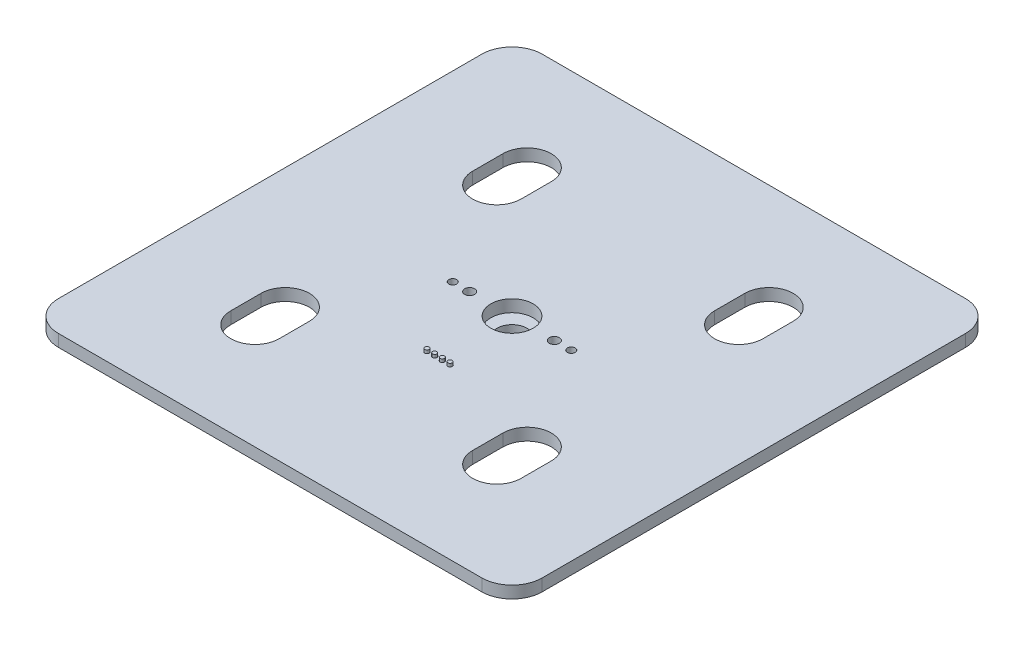
from build123d import *

# Parameters (mm, degrees)
SKETCH1_W                  = 80
SKETCH1_H                  = 80
BOSS_EXTRUDE1_DEPTH        = 1
FILLET1_R                  = 5
FILLET3_R                  = 5
FILLET4_R                  = 5
FILLET5_R                  = 5
CUT_EXTRUDE1_DEPTH         = 57.603886792
CUT_EXTRUDE1_DEPTH_BACK    = 57.603886792
CUT_EXTRUDE2_DEPTH         = 57.603886792
CUT_EXTRUDE2_DEPTH_BACK    = 57.603886792
SKETCH3_R                  = 3.5
CUT_EXTRUDE3_DEPTH         = 57.603886792
CUT_EXTRUDE3_DEPTH_BACK    = 57.603886792
SKETCH4_R                  = 0.38
SKETCH4_R_2                = 0.65
SKETCH4_R_3                = 0.825
BOSS_EXTRUDE2_START        = 1
BOSS_EXTRUDE2_DEPTH        = 4
BOSS_EXTRUDE3_DEPTH        = 0.5
BOSS_EXTRUDE3_DEPTH_BACK   = 5
SKETCH7_R                  = 0.35
BOSS_EXTRUDE3_2_DEPTH      = 0.5
BOSS_EXTRUDE3_2_DEPTH_BACK = 5
BOSS_EXTRUDE3_3_DEPTH      = 0.5
BOSS_EXTRUDE3_3_DEPTH_BACK = 5
BOSS_EXTRUDE3_4_DEPTH      = 0.5
BOSS_EXTRUDE3_4_DEPTH_BACK = 5
SKETCH8_W                  = 0.7
SKETCH8_H                  = 0.7
BOSS_EXTRUDE4_DEPTH        = 1.1
CUT_EXTRUDE4_DEPTH         = 58.063561053
CUT_EXTRUDE4_DEPTH_BACK    = 58.063561053
SKETCH9_R                  = 2.5


with BuildPart() as part:
    # Sketch1 → Boss-Extrude1 (new, symmetric)
    with BuildSketch(Plane(origin=(0, 0, 0), x_dir=(1, 0, 0), z_dir=(0, 1, 0))):
        Rectangle(SKETCH1_W, SKETCH1_H)
    extrude(amount=BOSS_EXTRUDE1_DEPTH, both=True)

    # Fillet1
    fillet1_edges = [part.edges().sort_by_distance(p)[0] for p in [
        (-40, 0, 40),
    ]]
    fillet(fillet1_edges, radius=FILLET1_R)

    # Fillet3
    fillet3_edges = [part.edges().sort_by_distance(p)[0] for p in [
        (-40, 0, -40),
    ]]
    fillet(fillet3_edges, radius=FILLET3_R)

    # Fillet4
    fillet4_edges = [part.edges().sort_by_distance(p)[0] for p in [
        (40, 0, -40),
    ]]
    fillet(fillet4_edges, radius=FILLET4_R)

    # Fillet5
    fillet5_edges = [part.edges().sort_by_distance(p)[0] for p in [
        (40, 0, 40),
    ]]
    fillet(fillet5_edges, radius=FILLET5_R)

    # Sketch2 → Cut-Extrude1 (cut, two sides: drawn at the far end of the back side and taken through both)
    with BuildSketch(Plane(origin=(0, 1, 0), x_dir=(1, 0, 0), z_dir=(0, 1, 0)).offset(-CUT_EXTRUDE1_DEPTH_BACK)):
        with BuildLine():
            Line((-24, 17.5), (-24, 22.5))
            ThreePointArc((-24, 22.5), (-20, 26.5), (-16, 22.5))
            Line((-16, 22.5), (-16, 17.5))
            ThreePointArc((-16, 17.5), (-20, 13.5), (-24, 17.5))
        make_face()
        with BuildLine():
            Line((-16, -17.5), (-16, -22.5))
            ThreePointArc((-16, -22.5), (-20, -26.5), (-24, -22.5))
            Line((-24, -22.5), (-24, -17.5))
            ThreePointArc((-24, -17.5), (-20, -13.5), (-16, -17.5))
        make_face()
        with BuildLine():
            Line((16, -17.5), (16, -22.5))
            ThreePointArc((16, -22.5), (20, -26.5), (24, -22.5))
            Line((24, -22.5), (24, -17.5))
            ThreePointArc((24, -17.5), (20, -13.5), (16, -17.5))
        make_face()
        with BuildLine():
            Line((24, 17.5), (24, 22.5))
            ThreePointArc((24, 22.5), (20, 26.5), (16, 22.5))
            Line((16, 22.5), (16, 17.5))
            ThreePointArc((16, 17.5), (20, 13.5), (24, 17.5))
        make_face()
    extrude(amount=CUT_EXTRUDE1_DEPTH + CUT_EXTRUDE1_DEPTH_BACK, mode=Mode.SUBTRACT)

    # Sketch3 → Cut-Extrude2 (cut, two sides: drawn at the far end of the back side and taken through both)
    with BuildSketch(Plane(origin=(0, 1, 0), x_dir=(1, 0, 0), z_dir=(0, 1, 0)).offset(-CUT_EXTRUDE2_DEPTH_BACK)):
        with Locations(Location((0, 0, 0), (0, 0, 270))):
            Circle(SKETCH3_R)
    extrude(amount=CUT_EXTRUDE2_DEPTH + CUT_EXTRUDE2_DEPTH_BACK, mode=Mode.SUBTRACT)

    # Sketch4 → Cut-Extrude3 (cut, two sides: drawn at the far end of the back side and taken through both)
    with BuildSketch(Plane(origin=(0, 1, 0), x_dir=(1, 0, 0), z_dir=(0, 1, 0)).offset(-CUT_EXTRUDE3_DEPTH_BACK)):
        with Locations(Location((-0.635, -12.15, 0), (0, 0, 270))):
            Circle(SKETCH4_R)
        with Locations(Location((-1.905, -12.15, 0), (0, 0, 270))):
            Circle(SKETCH4_R)
        with Locations(Location((-9.8, 0, 0), (0, 0, 270))):
            Circle(SKETCH4_R_2)
        with Locations(Location((-7, 0, 0), (0, 0, 270))):
            Circle(SKETCH4_R_3)
        with Locations(Location((7, 0, 0), (0, 0, 90))):
            Circle(SKETCH4_R_3)
        with Locations(Location((9.8, 0, 0), (0, 0, 90))):
            Circle(SKETCH4_R_2)
        with Locations(Location((0.635, -12.15, 0), (0, 0, 90))):
            Circle(SKETCH4_R)
        with Locations(Location((1.905, -12.15, 0), (0, 0, 90))):
            Circle(SKETCH4_R)
    extrude(amount=CUT_EXTRUDE3_DEPTH + CUT_EXTRUDE3_DEPTH_BACK, mode=Mode.SUBTRACT)


with BuildPart() as body_2:
    # Sketch6 → Boss-Extrude2 (new body)
    with BuildSketch(Plane.XZ.offset(1).offset(BOSS_EXTRUDE2_START)):
        with BuildLine():
            Line((-4.85, 8.745141508), (-4.85, 10.45))
            Line((-4.85, 10.45), (-3.2, 10.45))
            Line((-3.2, 10.45), (-3.2, 11.45))
            Line((-3.2, 11.45), (3.2, 11.45))
            Line((3.2, 11.45), (3.2, 10.45))
            Line((3.2, 10.45), (4.85, 10.45))
            Line((4.85, 10.45), (4.85, 8.745141508))
            ThreePointArc((4.85, 8.745141508), (0, -10), (-4.85, 8.745141508))
        make_face()
    extrude(amount=BOSS_EXTRUDE2_DEPTH)



with BuildPart() as body_3:
    # Sketch7 → Boss-Extrude3 (new, two sides: drawn at the far end of the back side and taken through both)
    with BuildSketch(Plane(origin=(0, 1, 0), x_dir=(1, 0, 0), z_dir=(0, 1, 0)).offset(-BOSS_EXTRUDE3_DEPTH_BACK)):
        with Locations(Location((-1.905, -12.15, 0), (0, 0, 270))):
            Circle(SKETCH7_R)
    extrude(amount=BOSS_EXTRUDE3_DEPTH + BOSS_EXTRUDE3_DEPTH_BACK)


with BuildPart() as body_4:
    # Sketch7 → Boss-Extrude3 2 (new, two sides: drawn at the far end of the back side and taken through both)
    with BuildSketch(Plane(origin=(0, 1, 0), x_dir=(1, 0, 0), z_dir=(0, 1, 0)).offset(-BOSS_EXTRUDE3_2_DEPTH_BACK)):
        with Locations(Location((-0.635, -12.15, 0), (0, 0, 270))):
            Circle(SKETCH7_R)
    extrude(amount=BOSS_EXTRUDE3_2_DEPTH + BOSS_EXTRUDE3_2_DEPTH_BACK)


with BuildPart() as body_5:
    # Sketch7 → Boss-Extrude3 3 (new, two sides: drawn at the far end of the back side and taken through both)
    with BuildSketch(Plane(origin=(0, 1, 0), x_dir=(1, 0, 0), z_dir=(0, 1, 0)).offset(-BOSS_EXTRUDE3_3_DEPTH_BACK)):
        with Locations(Location((0.635, -12.15, 0), (0, 0, 90))):
            Circle(SKETCH7_R)
    extrude(amount=BOSS_EXTRUDE3_3_DEPTH + BOSS_EXTRUDE3_3_DEPTH_BACK)


with BuildPart() as body_6:
    # Sketch7 → Boss-Extrude3 4 (new, two sides: drawn at the far end of the back side and taken through both)
    with BuildSketch(Plane(origin=(0, 1, 0), x_dir=(1, 0, 0), z_dir=(0, 1, 0)).offset(-BOSS_EXTRUDE3_4_DEPTH_BACK)):
        with Locations(Location((1.905, -12.15, 0), (0, 0, 90))):
            Circle(SKETCH7_R)
    extrude(amount=BOSS_EXTRUDE3_4_DEPTH + BOSS_EXTRUDE3_4_DEPTH_BACK)


with BuildPart() as body_2_1:
    add(body_2.part)

    add(body_3.part)  # Boss-Extrude4 merges body 3

    add(body_4.part)  # Boss-Extrude4 merges body 4

    add(body_5.part)  # Boss-Extrude4 merges body 5

    add(body_6.part)  # Boss-Extrude4 merges body 6
    # Sketch8 → Boss-Extrude4 (add)
    with BuildSketch(Plane.XY.offset(11.45)):
        with Locations((-1.905, -4.35)):
            Rectangle(SKETCH8_W, SKETCH8_H)
        with Locations((-0.635, -4.35)):
            Rectangle(SKETCH8_W, SKETCH8_H)
        with Locations((0.635, -4.35)):
            Rectangle(SKETCH8_W, SKETCH8_H)
        with Locations((1.905, -4.35)):
            Rectangle(SKETCH8_W, SKETCH8_H)
    extrude(amount=BOSS_EXTRUDE4_DEPTH)

    # Sketch9 → Cut-Extrude4 (cut, two sides: drawn at the far end of the back side and taken through both)
    with BuildSketch(Plane.XZ.offset(6).offset(-CUT_EXTRUDE4_DEPTH_BACK)):
        with Locations(Location((0, 0, 0), (0, 0, 270))):
            Circle(SKETCH9_R)
    extrude(amount=CUT_EXTRUDE4_DEPTH + CUT_EXTRUDE4_DEPTH_BACK, mode=Mode.SUBTRACT)


solid = Compound([part.part, body_2_1.part])
